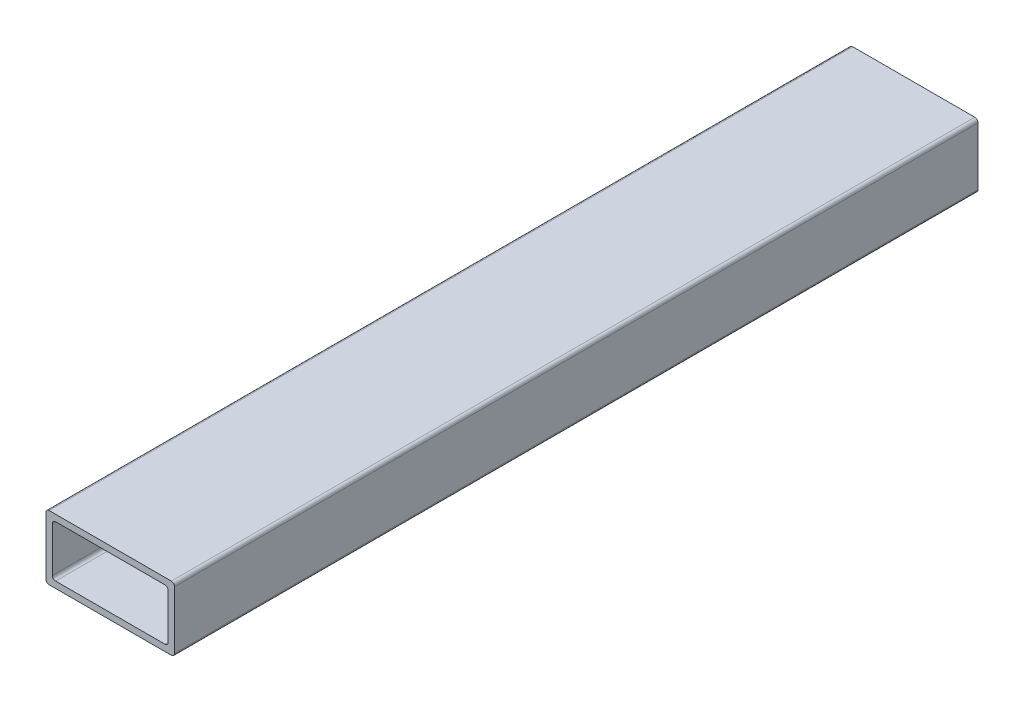
from build123d import *

# Parameters (mm, degrees)
BOSS_EXTRU_1_DEPTH = 500


with BuildPart() as part:
    # Esquisse2 → Boss.-Extru.1 (new body)
    with BuildSketch(Plane.XY):
        with BuildLine():
            Line((2, 0), (78, 0))
            ThreePointArc((78, 0), (79.414213562, 0.585786438), (80, 2))
            Line((80, 2), (80, 38))
            ThreePointArc((80, 38), (79.414213562, 39.414213562), (78, 40))
            Line((78, 40), (2, 40))
            ThreePointArc((2, 40), (0.585786438, 39.414213562), (0, 38))
            Line((0, 38), (0, 2))
            ThreePointArc((0, 2), (0.585786438, 0.585786438), (2, 0))
        make_face()
        with BuildLine():
            Line((6, 4), (74, 4))
            ThreePointArc((74, 4), (75.414213562, 4.585786438), (76, 6))
            Line((76, 6), (76, 34))
            ThreePointArc((76, 34), (75.414213562, 35.414213562), (74, 36))
            Line((74, 36), (6, 36))
            ThreePointArc((6, 36), (4.585786438, 35.414213562), (4, 34))
            Line((4, 34), (4, 6))
            ThreePointArc((4, 6), (4.585786438, 4.585786438), (6, 4))
        make_face(mode=Mode.SUBTRACT)
    extrude(amount=BOSS_EXTRU_1_DEPTH)


solid = part.part
